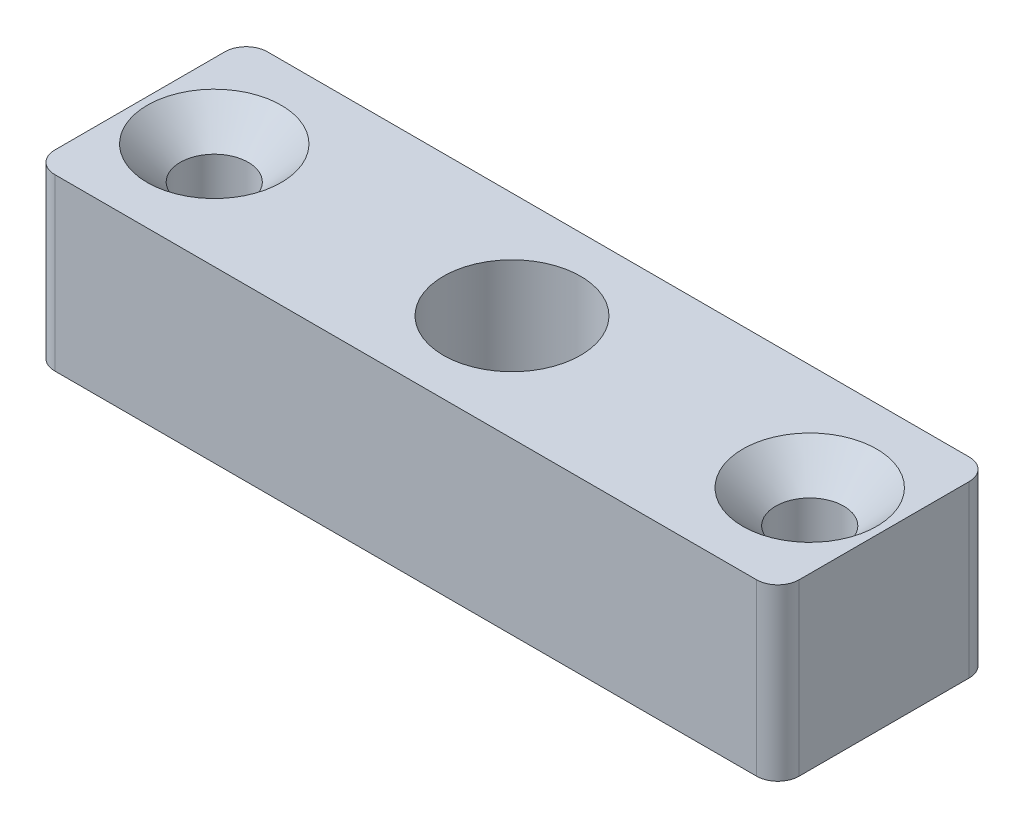
from build123d import *

# Parameters (mm, degrees)
SKETCH1_W                                       = 35
SKETCH1_H                                       = 10
BOSS_EXTRUDE1_DEPTH                             = 8
CSK_FOR_M3_FLAT_HEAD_MACHINE_SCREW1_D           = 3.2
CSK_FOR_M3_FLAT_HEAD_MACHINE_SCREW1_CSINK_D     = 6.3
CSK_FOR_M3_FLAT_HEAD_MACHINE_SCREW1_CSINK_ANGLE = 90
SKETCH1_3_R                                     = 3.225
CUT_EXTRUDE2_DEPTH                              = 6.35
FILLET1_R                                       = 1


with BuildPart() as part:
    # Sketch1 → Boss-Extrude1 (new body)
    with BuildSketch(Plane(origin=(0, 0, 0), x_dir=(1, 0, 0), z_dir=(0, 1, 0))):
        Rectangle(SKETCH1_W, SKETCH1_H)
    extrude(amount=-BOSS_EXTRUDE1_DEPTH)

    # CSK for M3 Flat Head Machine Screw1 (through all)
    with Locations(Plane(origin=(-14, 0, 0), x_dir=(0, 0, 1), z_dir=(0, 1, 0))):
        with Locations((0, 0), (0, 28)):
            CounterSinkHole(CSK_FOR_M3_FLAT_HEAD_MACHINE_SCREW1_D / 2, CSK_FOR_M3_FLAT_HEAD_MACHINE_SCREW1_CSINK_D / 2, counter_sink_angle=CSK_FOR_M3_FLAT_HEAD_MACHINE_SCREW1_CSINK_ANGLE)

    # Sketch1<3> → Cut-Extrude2 (cut)
    with BuildSketch(Plane(origin=(0, 0, 0), x_dir=(1, 0, 0), z_dir=(0, 1, 0))):
        Circle(SKETCH1_3_R)
    extrude(amount=-CUT_EXTRUDE2_DEPTH, mode=Mode.SUBTRACT)

    # Fillet1
    fillet1_edges = [part.edges().sort_by_distance(p)[0] for p in [
        (17.5, -4, -5),
        (17.5, -4, 5),
        (-17.5, -4, -5),
        (-17.5, -4, 5),
    ]]
    fillet(fillet1_edges, radius=FILLET1_R)


solid = part.part
